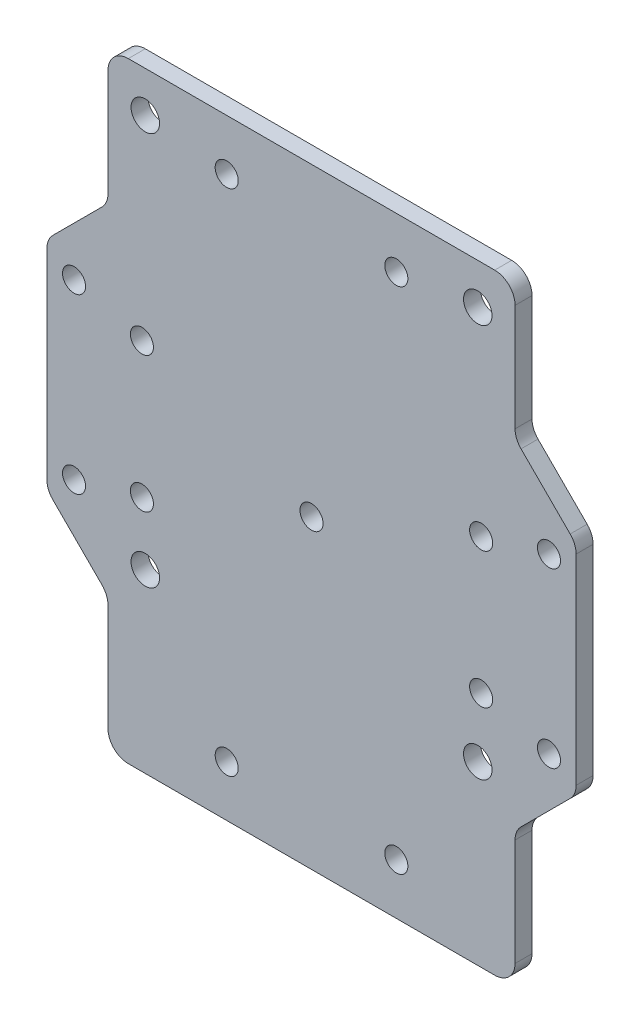
from build123d import *

# Parameters (mm, degrees)
SKETCH1_W                  = 60
SKETCH1_H                  = 90
BOSS_EXTRUDE1_DEPTH        = 1.25
FILLET1_R                  = 3
F_4_2_4_2_DIAMETER_HOLE1_D = 4.2
M3_CLEARANCE_HOLE1_D       = 3.4
M3_CLEARANCE_HOLE2_D       = 3.4
M3_CLEARANCE_HOLE3_D       = 3.4


with BuildPart() as part:
    # Sketch1 → Boss-Extrude1 (new, symmetric)
    with BuildSketch(Plane.XY):
        Polygon((-30, 25), (-30, -25), (-30, -45), (30, -45), (30, -25), (30, 25), (30, 45), (-30, 45), align=None)
        Rectangle(SKETCH1_W, SKETCH1_H)
        Polygon((-39, 16), (-39, -16), (-30, -25), (-30, 25), align=None)
        Polygon((30, 25), (30, -25), (39, -16), (39, 16), align=None)
    extrude(amount=BOSS_EXTRUDE1_DEPTH, both=True)

    # Fillet1
    fillet1_edges = [part.edges().sort_by_distance(p)[0] for p in [
        (30, 25, 0),
        (39, 16, 0),
        (39, -16, 0),
        (30, -25, 0),
        (30, -45, 0),
        (-30, -45, 0),
        (-30, -25, 0),
        (-39, -16, 0),
        (-39, 16, 0),
        (-30, 25, 0),
        (-30, 45, 0),
        (30, 45, 0),
    ]]
    fillet(fillet1_edges, radius=FILLET1_R)

    # Ø4.2 (4.2) Diameter Hole1 (through all)
    with Locations(Plane(origin=(0, 0, -1.25), x_dir=(-1, 0, 0), z_dir=(0, 0, -1))):
        with Locations((-24.5, -19), (24.5, -19), (24.5, 39), (-24.5, 39)):
            Hole(F_4_2_4_2_DIAMETER_HOLE1_D / 2)

    # M3 Clearance Hole1 (through all)
    with Locations(Plane(origin=(0, 0, -1.25), x_dir=(-1, 0, 0), z_dir=(0, 0, -1))):
        with Locations((-35, 12.75), (-35, -12.75), (35, -12.75), (35, 12.75)):
            Hole(M3_CLEARANCE_HOLE1_D / 2)

    # M3 Clearance Hole2 (through all)
    with Locations(Plane.XY.offset(1.25)):
        with Locations((-12.5, -37.5), (12.5, -37.5), (-12.5, 37.5), (12.5, 37.5), (-25, 10), (-25, -10), (25, -10), (25, 10)):
            Hole(M3_CLEARANCE_HOLE2_D / 2)

    # M3 Clearance Hole3 (through all)
    with Locations(Plane.XY.offset(1.25)):
        with Locations((0, 0)):
            Hole(M3_CLEARANCE_HOLE3_D / 2)


solid = part.part
